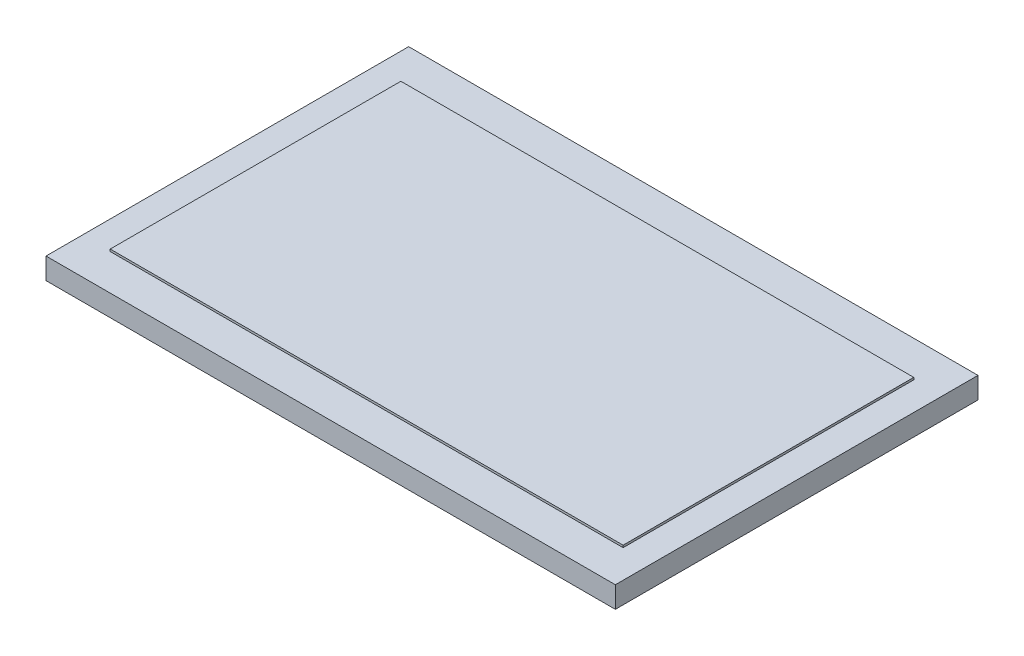
from build123d import *

# Parameters (mm, degrees)
SKETCH1_W           = 105.5
SKETCH1_H           = 67.2
BOSS_EXTRUDE1_DEPTH = 3.95
SKETCH2_W           = 95.04
SKETCH2_H           = 53.856
BOSS_EXTRUDE2_DEPTH = 0.4


with BuildPart() as part:
    # Sketch1 → Boss-Extrude1 (new body)
    with BuildSketch(Plane(origin=(0, 0, 0), x_dir=(1, 0, 0), z_dir=(0, 1, 0))):
        with Locations((52.75, 33.6)):
            Rectangle(SKETCH1_W, SKETCH1_H)
    extrude(amount=BOSS_EXTRUDE1_DEPTH)

    # Sketch2 → Boss-Extrude2 (add)
    with BuildSketch(Plane(origin=(0, 3.95, 0), x_dir=(1, 0, 0), z_dir=(0, 1, 0))):
        with Locations((52.75, 33.598)):
            Rectangle(SKETCH2_W, SKETCH2_H)
    extrude(amount=BOSS_EXTRUDE2_DEPTH)


solid = part.part
